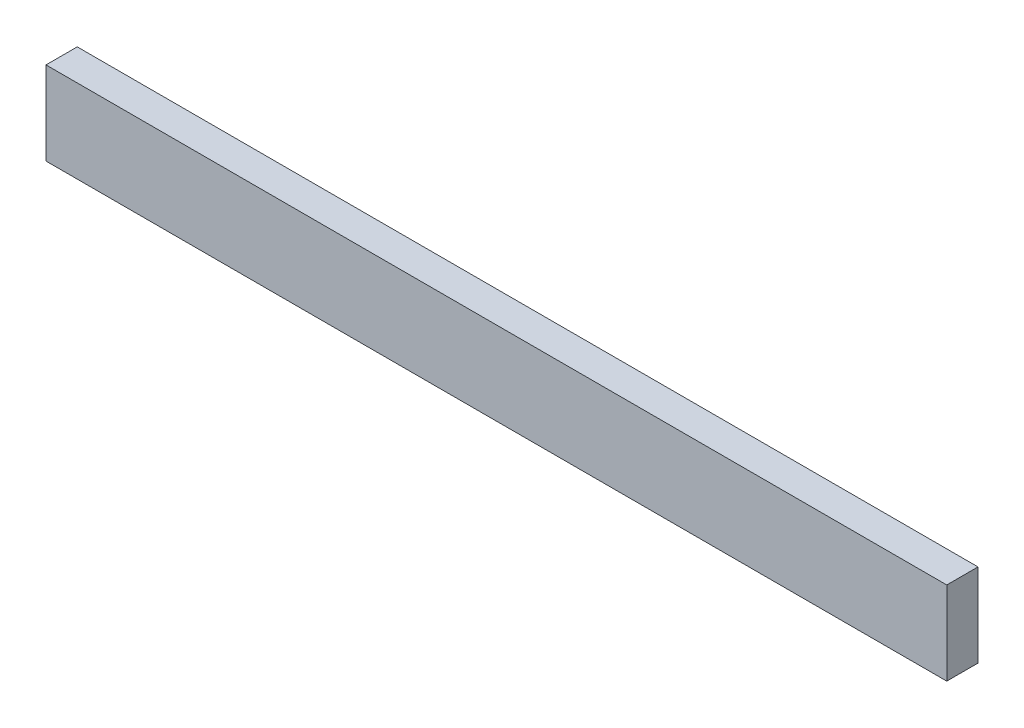
from build123d import *

# Parameters (mm, degrees)
ESQUISSE1_W        = 432.465319529
ESQUISSE1_H        = 40
BOSS_EXTRU_1_DEPTH = 15


with BuildPart() as part:
    # Esquisse1 → Boss.-Extru.1 (new body)
    with BuildSketch(Plane.XY):
        with Locations((-201.232659764, -489.409867617)):
            Rectangle(ESQUISSE1_W, ESQUISSE1_H)
    extrude(amount=BOSS_EXTRU_1_DEPTH)


solid = part.part
